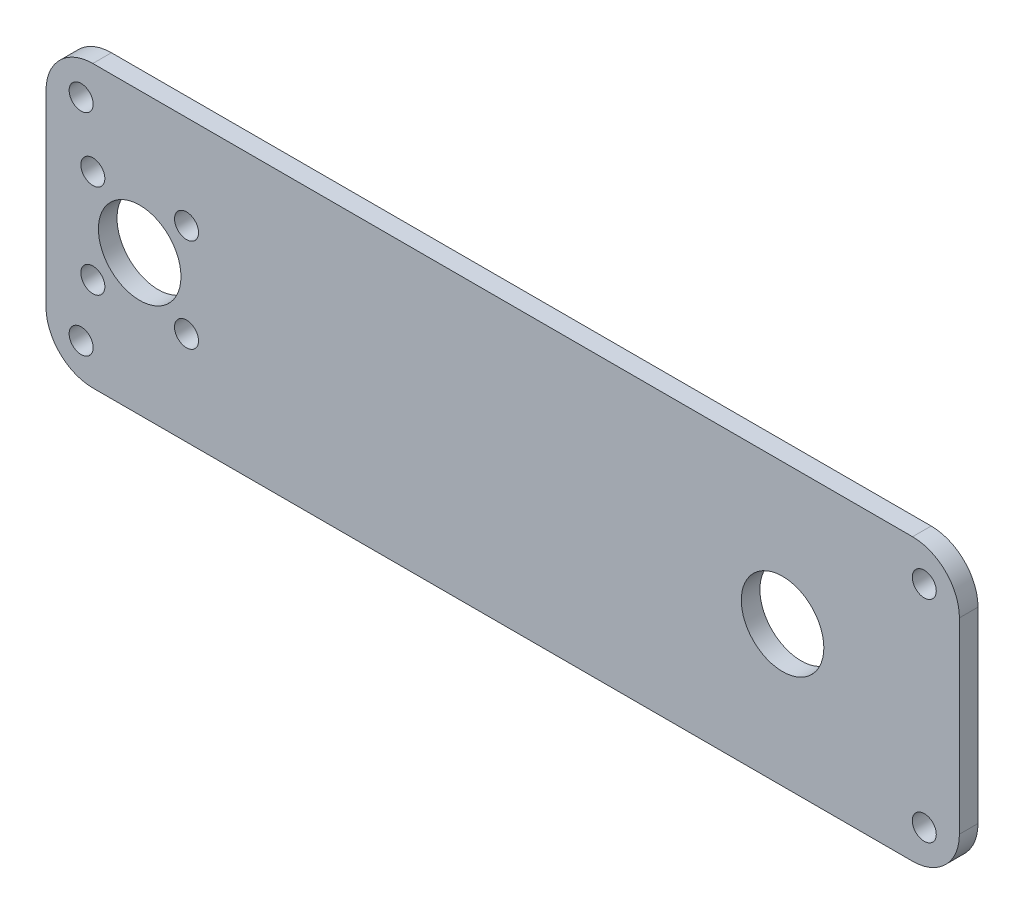
from build123d import *

# Parameters (mm, degrees)
SKETCH2_W           = 156
SKETCH2_H           = 48
SKETCH2_R           = 2.05
SKETCH2_R_2         = 7.05
BOSS_EXTRUDE2_DEPTH = 3.175
FILLET1_R           = 8


with BuildPart() as part:
    # Sketch2 → Boss-Extrude2 (new body)
    with BuildSketch(Plane.XY):
        Rectangle(SKETCH2_W, SKETCH2_H)
        with Locations((-70, 8)):
            Circle(SKETCH2_R, mode=Mode.SUBTRACT)
        with Locations((-54, 8)):
            Circle(SKETCH2_R, mode=Mode.SUBTRACT)
        with Locations((-54, -8)):
            Circle(SKETCH2_R, mode=Mode.SUBTRACT)
        with Locations((-70, -8)):
            Circle(SKETCH2_R, mode=Mode.SUBTRACT)
        with Locations((47.795580317, 0)):
            Circle(SKETCH2_R_2, mode=Mode.SUBTRACT)
        with Locations((-62, 0)):
            Circle(SKETCH2_R_2, mode=Mode.SUBTRACT)
        with Locations((72, 18)):
            Circle(SKETCH2_R, mode=Mode.SUBTRACT)
        with Locations((72, -18)):
            Circle(SKETCH2_R, mode=Mode.SUBTRACT)
        with Locations((-72, -18)):
            Circle(SKETCH2_R, mode=Mode.SUBTRACT)
        with Locations((-72, 18)):
            Circle(SKETCH2_R, mode=Mode.SUBTRACT)
    extrude(amount=BOSS_EXTRUDE2_DEPTH)

    # Fillet1
    fillet1_edges = [part.edges().sort_by_distance(p)[0] for p in [
        (78, 24, 1.5875),
        (78, -24, 1.5875),
        (-78, -24, 1.5875),
        (-78, 24, 1.5875),
    ]]
    fillet(fillet1_edges, radius=FILLET1_R)


solid = part.part
